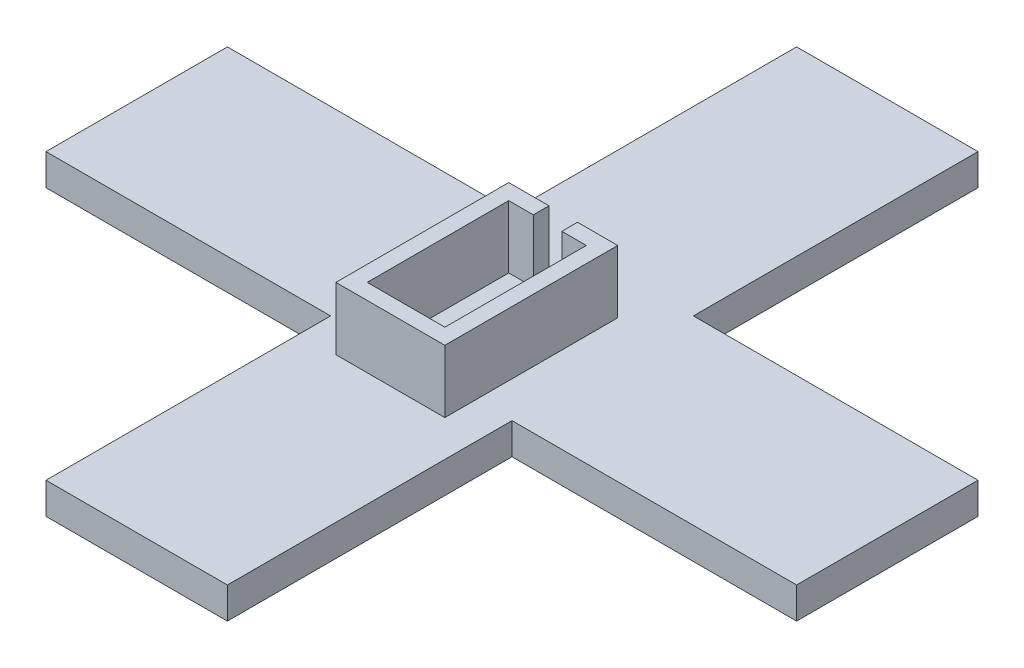
from build123d import *

# Parameters (mm, degrees)
BOSS_EXTRUDE18_DEPTH = 5
BOSS_EXTRUDE19_DEPTH = 10


with BuildPart() as part:
    # Sketch21 → Boss-Extrude18 (new body)
    with BuildSketch(Plane(origin=(0, 0, 0), x_dir=(1, 0, 0), z_dir=(0, 1, 0))):
        Polygon((0, 59.92), (-14.48, 59.92), (-14.48, 14.48), (-59.92, 14.48), (-59.92, 0), (-59.92, -14.48), (-14.48, -14.48), (-14.48, -59.92), (0, -59.92), (14.48, -59.92), (14.48, -14.48), (59.92, -14.48), (59.92, 0), (59.92, 14.48), (14.48, 14.48), (14.48, 59.92), align=None)
    extrude(amount=BOSS_EXTRUDE18_DEPTH)

    # Sketch23 → Boss-Extrude19 (add)
    with BuildSketch(Plane(origin=(0, 5, 0), x_dir=(1, 0, 0), z_dir=(0, 1, 0))):
        Polygon((-8.7, 8.18), (-2.28, 8.18), (-2.28, 5.68), (-6.2, 5.68), (-6.2, -16.92), (6.2, -16.92), (6.2, 5.68), (2.28, 5.68), (2.28, 8.18), (8.7, 8.18), (8.7, -19.42), (-8.7, -19.42), align=None)
    extrude(amount=BOSS_EXTRUDE19_DEPTH)


solid = part.part
